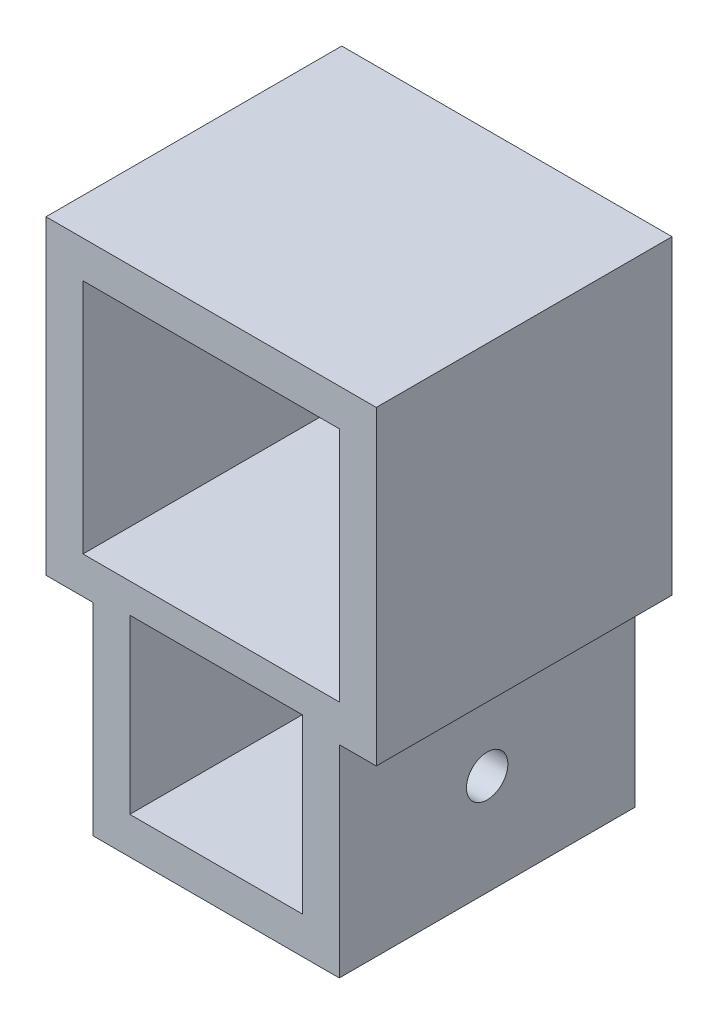
from build123d import *

# Parameters (mm, degrees)
RESSALTO_EXTRUS_O2_DEPTH = 30
ESBO_O2_R                = 2.1
CORTE_EXTRUS_O1_DEPTH    = 63.691779646


with BuildPart() as part:
    # Esboço1 → Ressalto-extrusão2 (new body)
    with BuildSketch(Plane.XY):
        Polygon((-28.75, 15.443548387), (-28.75, -5.056451613), (-3.75, -5.056451613), (-3.75, 15.443548387), (0, 15.443548387), (0, 46.943548387), (-33.5, 46.943548387), (-33.5, 15.443548387), align=None)
        Polygon((-25, 15.443548387), (-25, -1.306451613), (-7.5, -1.306451613), (-7.5, 15.443548387), (-7.5, 16.193548387), (-25, 16.193548387), align=None, mode=Mode.SUBTRACT)
        Polygon((-25, 19.193548387), (-29.75, 19.193548387), (-29.75, 43.193548387), (-3.75, 43.193548387), (-3.75, 19.193548387), (-7.5, 19.193548387), align=None, mode=Mode.SUBTRACT)
    extrude(amount=RESSALTO_EXTRUS_O2_DEPTH)

    # Esboço2 → Corte-extrusão1 (cut, through all)
    with BuildSketch(Plane.ZY.offset(28.75)):
        with Locations(Location((15, 5.193548387, 0), (0, 0, 270))):
            Circle(ESBO_O2_R)
    extrude(amount=-CORTE_EXTRUS_O1_DEPTH, mode=Mode.SUBTRACT)


solid = part.part
